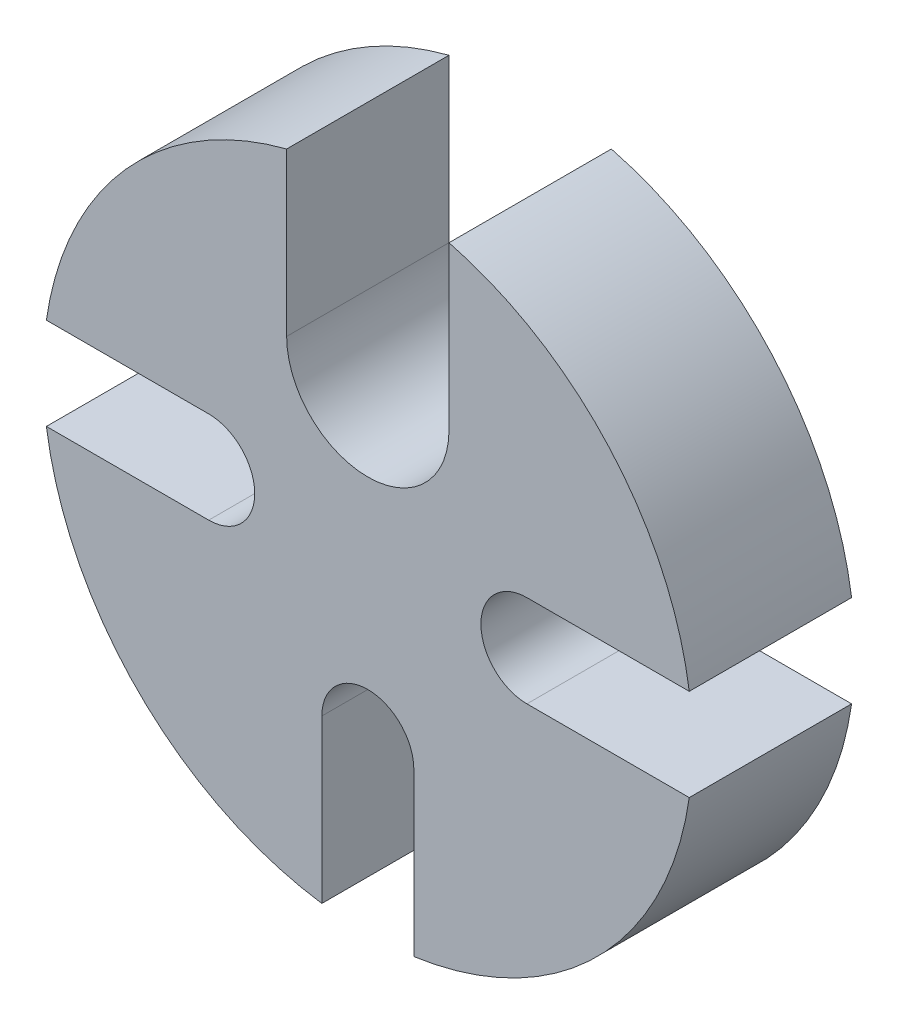
from build123d import *

# Parameters (mm, degrees)
SKETCH1_W          = 1524
SKETCH1_H          = 762
CUT_EXTRUDE1_DEPTH = 2287
CUT_EXTRUDE2_DEPTH = 2287
CUT_EXTRUDE3_DEPTH = 2287
CUT_EXTRUDE4_DEPTH = 2276.781885419
SKETCH6_W          = 50.8
SKETCH6_H          = 762


with BuildPart() as part:
    # Sketch1 → Revolve1 (revolve)
    with BuildSketch(Plane(origin=(0, 0, 0), x_dir=(1, 0, 0), z_dir=(0, 1, 0))):
        with Locations((762, -381)):
            Rectangle(SKETCH1_W, SKETCH1_H)
    revolve(axis=Axis((0, 0, 0), (0, 0, 1)))

    # Sketch2 → Cut-Extrude1 (cut, through all)
    with BuildSketch(Plane(origin=(0, 0, 0), x_dir=(-1, 0, 0), z_dir=(0, 0, -1))):
        with BuildLine():
            Line((215.9, -1508.629573487), (215.9, -746.76))
            ThreePointArc((215.9, -746.76), (0, -530.86), (-215.9, -746.76))
            Line((-215.9, -746.76), (-215.9, -1508.629573487))
            ThreePointArc((-215.9, -1508.629573487), (0, -1524), (215.9, -1508.629573487))
        make_face()
    extrude(amount=-CUT_EXTRUDE1_DEPTH, mode=Mode.SUBTRACT)

    # Sketch3 → Cut-Extrude2 (cut, through all)
    with BuildSketch(Plane(origin=(0, 0, 0), x_dir=(-1, 0, 0), z_dir=(0, 0, -1))):
        with BuildLine():
            Line((-1508.629573487, -215.9), (-746.76, -215.9))
            ThreePointArc((-746.76, -215.9), (-530.86, 0), (-746.76, 215.9))
            Line((-746.76, 215.9), (-1508.629573487, 215.9))
            ThreePointArc((-1508.629573487, 215.9), (-1524, 0), (-1508.629573487, -215.9))
        make_face()
    extrude(amount=-CUT_EXTRUDE2_DEPTH, mode=Mode.SUBTRACT)

    # Sketch4 → Cut-Extrude3 (cut, through all)
    with BuildSketch(Plane(origin=(0, 0, 0), x_dir=(-1, 0, 0), z_dir=(0, 0, -1))):
        with BuildLine():
            Line((-381, 1475.606654905), (-381, 713.739999999))
            ThreePointArc((-381, 713.739999999), (0, 332.739999999), (381, 713.739999999))
            Line((381, 713.739999999), (381, 1475.606654905))
            ThreePointArc((381, 1475.606654905), (0, 1524), (-381, 1475.606654905))
        make_face()
    extrude(amount=-CUT_EXTRUDE3_DEPTH, mode=Mode.SUBTRACT)

    # Sketch5 → Cut-Extrude4 (cut, through all)
    with BuildSketch(Plane(origin=(0, 0, 0), x_dir=(-1, 0, 0), z_dir=(0, 0, -1))):
        with BuildLine():
            Line((1508.629573487, 215.9), (746.76, 215.9))
            ThreePointArc((746.76, 215.9), (530.86, 0), (746.76, -215.9))
            Line((746.76, -215.9), (1508.629573487, -215.9))
            ThreePointArc((1508.629573487, -215.9), (1524, 0), (1508.629573487, 215.9))
        make_face()
    extrude(amount=-CUT_EXTRUDE4_DEPTH, mode=Mode.SUBTRACT)

    # Sketch6 → Revolve2 (revolve)
    with BuildSketch(Plane.XZ, mode=Mode.PRIVATE) as revolve2_sk:
        with Locations((25.4, -381)):
            Rectangle(SKETCH6_W, SKETCH6_H)
    revolve(revolve2_sk.sketch.rotate(Axis((0, 0, 0), (0, 0, -1)), 180), axis=Axis((0, 0, 0), (0, 0, -1)))


solid = part.part
